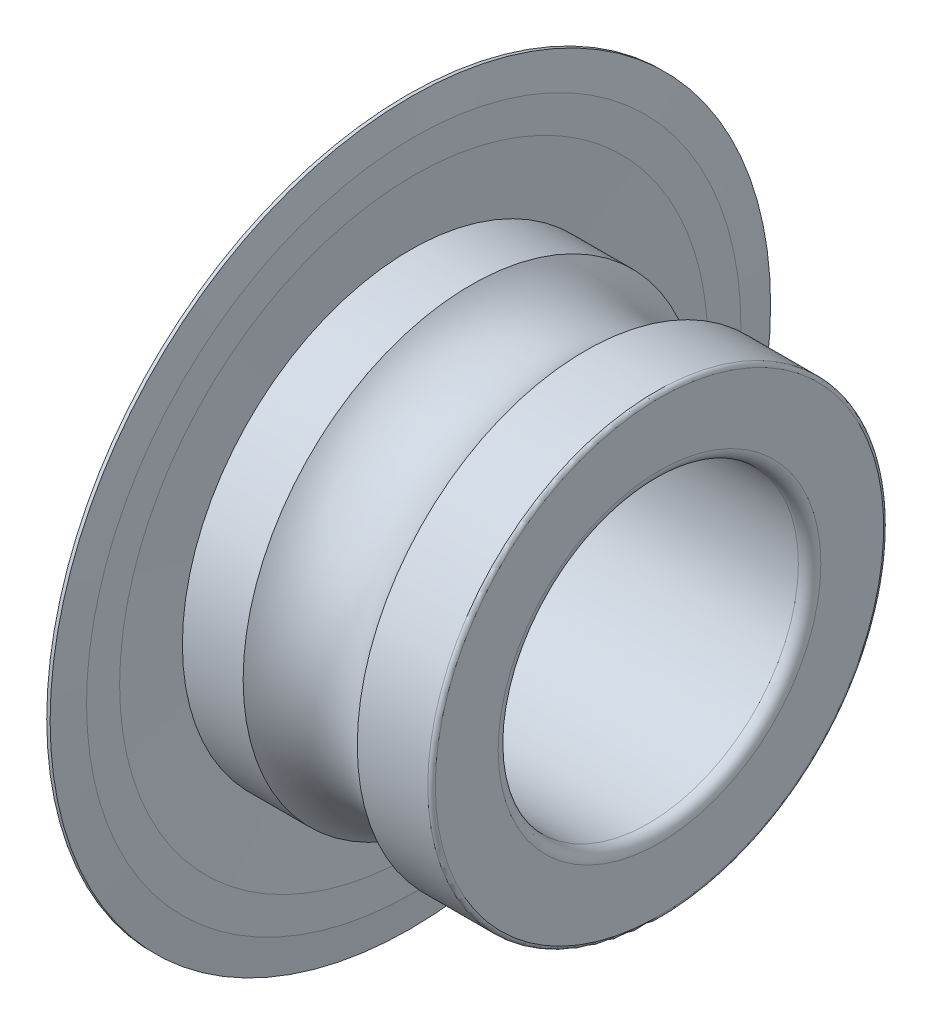
from build123d import *


with BuildPart() as part:
    # Sketch1 → Revolução1 (revolve)
    with BuildSketch(Plane.XY, mode=Mode.PRIVATE) as revolu_o1_sk:
        with BuildLine():
            Line((0, 5.975), (0, 4.3))
            ThreePointArc((0, 4.3), (0.087867966, 4.087867966), (0.3, 4))
            Line((0.3, 4), (6.7, 4))
            ThreePointArc((6.7, 4), (6.912132034, 4.087867966), (7, 4.3))
            Line((7, 4.3), (7, 5.975))
            ThreePointArc((7, 5.975), (6.970710678, 6.045710678), (6.9, 6.075))
            Line((6.9, 6.075), (5.020728526, 6.075))
            ThreePointArc((5.020728526, 6.075), (3.5, 5.3655), (1.979271474, 6.075))
            Line((1.979271474, 6.075), (0.1, 6.075))
            ThreePointArc((0.1, 6.075), (0.029289322, 6.045710678), (0, 5.975))
        make_face()
    revolve(revolu_o1_sk.sketch.rotate(Axis((50, 0, 0), (-1, 0, 0)), 270), axis=Axis((50, 0, 0), (-1, 0, 0)))

    # Sketch2 → Revolução2 (revolve)
    with BuildSketch(Plane.XY, mode=Mode.PRIVATE) as revolu_o2_sk:
        Polygon((0.27, 9.6), (0.315, 8.71875), (0.27, 7.8375), (0.27, 6.075), (0.36, 6.075), (0.45, 7.8375), (0.45, 8.71875), (0.36, 9.6), align=None)
    revolve(revolu_o2_sk.sketch.rotate(Axis((50, 0, 0), (-1, 0, 0)), 270), axis=Axis((50, 0, 0), (-1, 0, 0)))


solid = part.part
